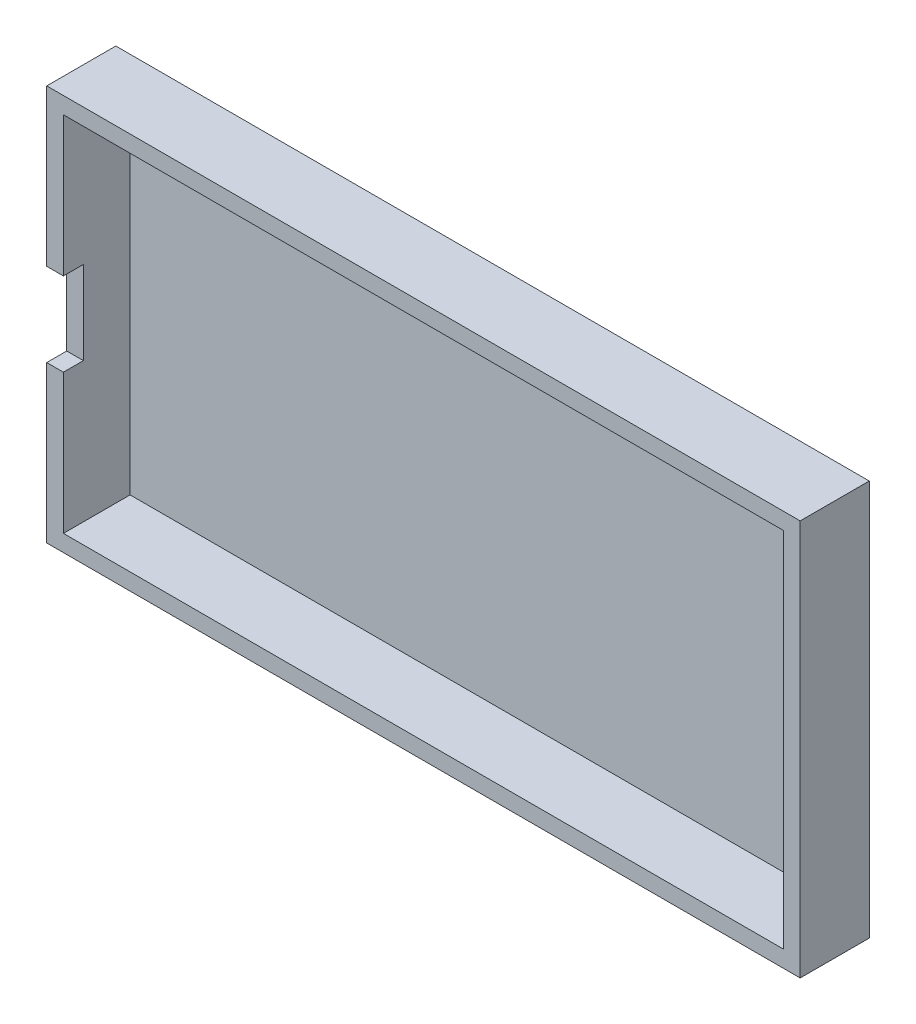
from build123d import *

# Parameters (mm, degrees)
BOSS_EXTRUDE2_DEPTH = 0.059386
CUT_EXTRUDE2_DEPTH  = 1.131952574
CUT_EXTRUDE3_DEPTH  = 1.131952731
SKETCH12_W          = 0.108021848
SKETCH12_H          = 0.054386384
CUT_EXTRUDE4_DEPTH  = 0.01
SKETCH13_W          = 0.003
SKETCH13_H          = 0.0125
CUT_EXTRUDE5_DEPTH  = 0.01


with BuildPart() as part:
    # Sketch6 → Boss-Extrude2 (new body)
    with BuildSketch(Plane(origin=(0, -0.029692013, 0), x_dir=(1, 0, 0), z_dir=(0, 1, 0))):
        Polygon((-0.05760873, -0.044406825), (-0.054770597, -0.041568568), (0.052574986, -0.041568568), (0.055413118, -0.044406577), (0.055413118, -0.058446429), (0.052574986, -0.061284671), (-0.054770597, -0.061284671), (-0.05760873, -0.058446647), align=None)
    extrude(amount=BOSS_EXTRUDE2_DEPTH)

    # Sketch10 → Cut-Extrude2 (cut, through all)
    with BuildSketch(Plane(origin=(-0.05760873, 0, 0), x_dir=(0, 0, -1), z_dir=(1, 0, 0))):
        Polygon((-0.061284671, 0.02685612), (-0.058446429, 0.029694371), (-0.061284671, 0.029694371), align=None)
        Polygon((-0.041568568, 0.02685612), (-0.044406577, 0.029694371), (-0.041568568, 0.029694371), align=None)
        Polygon((-0.058446429, -0.029692013), (-0.061284671, -0.026853766), (-0.061284671, -0.029692013), align=None)
        Polygon((-0.044406825, -0.029692013), (-0.041568568, -0.026853766), (-0.041568568, -0.029692013), align=None)
    extrude(amount=CUT_EXTRUDE2_DEPTH, mode=Mode.SUBTRACT)

    # Sketch11 → Cut-Extrude3 (cut, through all)
    with BuildSketch(Plane.ZY.offset(0.05760873)):
        Polygon((0.054768568, 0.029694371), (0.054768568, -0.029692013), (0.058446647, -0.029692013), (0.061284671, -0.026853766), (0.061284671, 0.02685612), (0.058446429, 0.029694371), align=None)
    extrude(amount=-CUT_EXTRUDE3_DEPTH, mode=Mode.SUBTRACT)

    # Sketch12 → Cut-Extrude4 (cut)
    with BuildSketch(Plane.XY.offset(0.054768568)):
        with Locations((-0.001097806, 1.179e-06)):
            Rectangle(SKETCH12_W, SKETCH12_H)
    extrude(amount=-CUT_EXTRUDE4_DEPTH, mode=Mode.SUBTRACT)

    # Sketch13 → Cut-Extrude5 (cut)
    with BuildSketch(Plane.ZY.offset(0.05760873)):
        with Locations((0.053268568, 1.179e-06)):
            Rectangle(SKETCH13_W, SKETCH13_H)
    extrude(amount=-CUT_EXTRUDE5_DEPTH, mode=Mode.SUBTRACT)


solid = part.part
